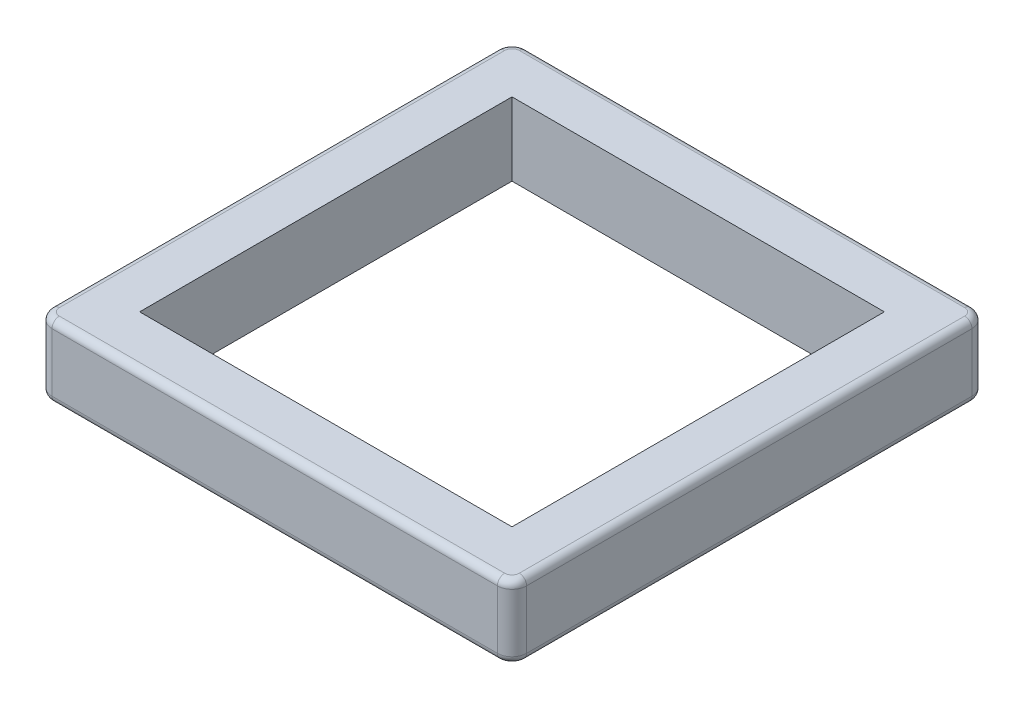
from build123d import *

# Parameters (mm, degrees)
SKETCH1_W           = 825.5
SKETCH1_H           = 825.5
SKETCH1_W_2         = 647.7
SKETCH1_H_2         = 647.7
BOSS_EXTRUDE1_DEPTH = 127
FILLET1_R           = 25.4
FILLET2_R           = 12.7
SKETCH2_W           = 34.200403136
SKETCH2_H           = 9.659395297
CUT_EXTRUDE1_DEPTH  = 5.08


with BuildPart() as part:
    # Sketch1 → Boss-Extrude1 (new body)
    with BuildSketch(Plane(origin=(0, 0, 0), x_dir=(1, 0, 0), z_dir=(0, 1, 0))):
        Rectangle(SKETCH1_W, SKETCH1_H)
        Rectangle(SKETCH1_W_2, SKETCH1_H_2, mode=Mode.SUBTRACT)
    extrude(amount=BOSS_EXTRUDE1_DEPTH)

    # Fillet1
    fillet1_edges = [part.edges().sort_by_distance(p)[0] for p in [
        (412.75, 63.5, 412.75),
        (-412.75, 63.5, 412.75),
        (-412.75, 63.5, -412.75),
        (412.75, 63.5, -412.75),
    ]]
    fillet(fillet1_edges, radius=FILLET1_R)

    # Fillet2
    fillet2_edges = [part.edges().sort_by_distance(p)[0] for p in [
        (-412.75, 0, 0),
        (-412.75, 127, 0),
        (412.75, 0, 0),
        (0, 0, 412.75),
        (0, 0, -412.75),
        (405.310512242, 0, 405.310512242),
        (405.310512242, 0, -405.310512242),
        (-405.310512242, 0, 405.310512242),
        (-405.310512242, 0, -405.310512242),
        (0, 127, -412.75),
        (412.75, 127, 0),
        (0, 127, 412.75),
        (405.310512242, 127, 405.310512242),
        (405.310512242, 127, -405.310512242),
        (-405.310512242, 127, 405.310512242),
        (-405.310512242, 127, -405.310512242),
    ]]
    fillet(fillet2_edges, radius=FILLET2_R)

    # Sketch2 → Cut-Extrude1 (cut)
    # profile 1 of 4: a face of its own
    with BuildSketch(Plane.ZY.offset(412.75)):
        Polygon((-121.32268757, 97.79), (-233.139574468, 97.79), (-211.090212766, 78.795464726), (-153.406898096, 78.795464726), (-153.406898096, 69.136069429), (-219.691511758, 69.136069429), (-219.691511758, 50.260996641), (-153.406898096, 50.260996641), (-153.406898096, 40.465072788), (-219.691511758, 40.465072788), (-219.691511758, 21.59), (-121.32268757, 21.59), align=None)
    # profile 2 of 4: a face of its own
    with BuildSketch(Plane.ZY.offset(412.75)):
        Polygon((-4.812631579, 97.79), (-116.271131019, 97.79), (-93.624456887, 78.795464726), (-48.928421053, 78.795464726), (-102.823068309, 21.59), (-59.065666293, 21.59), (-4.812631579, 78.795464726), align=None)
    # profile 3 of 4: a face of its own
    with BuildSketch(Plane.ZY.offset(412.75)):
        Polygon((80.329988802, 50.260996641), (80.329988802, 40.465072788), (14.147771557, 40.465072788), (14.147771557, 21.59), (112.294736842, 21.59), (112.294736842, 97.79), (0.59731243, 97.79), (14.147771557, 86.475195969), (14.147771557, 50.260996641), align=None)
        with Locations((63.229787234, 73.965767078)):
            Rectangle(SKETCH2_W, SKETCH2_H, mode=Mode.SUBTRACT)
    # profile 4 of 4: a face of its own
    with BuildSketch(Plane.ZY.offset(412.75)):
        Polygon((229.282642777, 97.79), (117.465755879, 97.79), (131.016215006, 86.475195969), (131.016215006, 78.795464726), (197.198432251, 78.795464726), (197.198432251, 69.136069429), (130.913818589, 69.136069429), (130.913818589, 21.59), (228.924255319, 21.59), (228.924255319, 40.465072788), (162.878566629, 40.465072788), (162.878566629, 50.260996641), (229.282642777, 50.260996641), align=None)
    extrude(amount=-CUT_EXTRUDE1_DEPTH, mode=Mode.SUBTRACT)


solid = part.part
